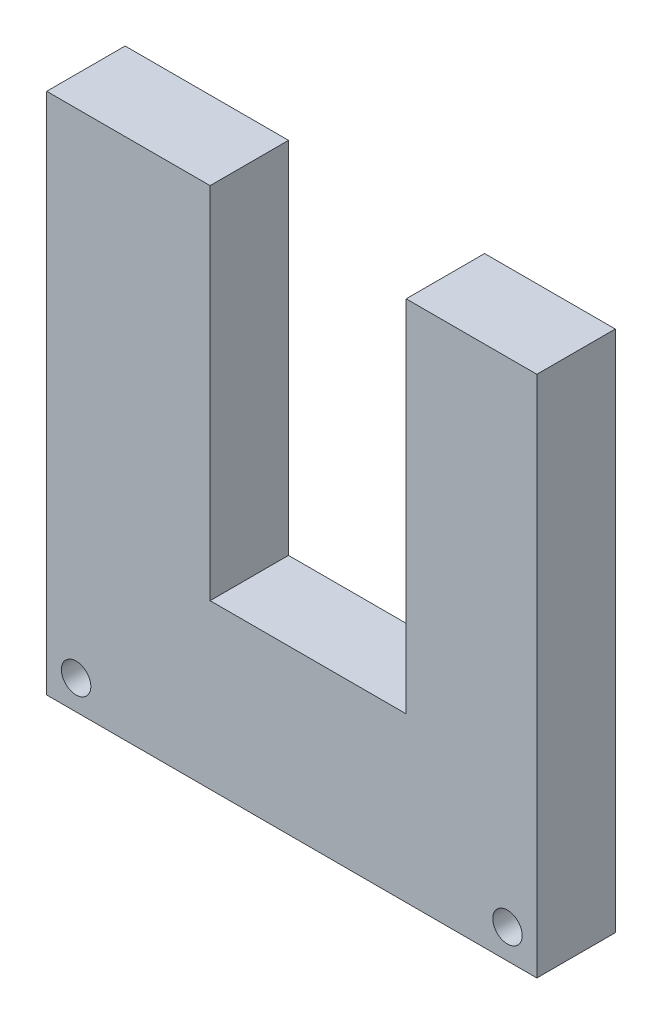
from build123d import *

# Parameters (mm, degrees)
SKETCH2_R           = 2.25
BOSS_EXTRUDE1_DEPTH = 12


with BuildPart() as part:
    # Sketch2 → Boss-Extrude1 (new body)
    with BuildSketch(Plane.XY):
        Polygon((0, 0), (0, 80), (25, 80), (25, 25), (55, 25), (55, 80), (75, 80), (75, 0), align=None)
        with Locations((70.5, 4.5)):
            Circle(SKETCH2_R, mode=Mode.SUBTRACT)
        with Locations((4.5, 4.5)):
            Circle(SKETCH2_R, mode=Mode.SUBTRACT)
    extrude(amount=BOSS_EXTRUDE1_DEPTH)


solid = part.part
